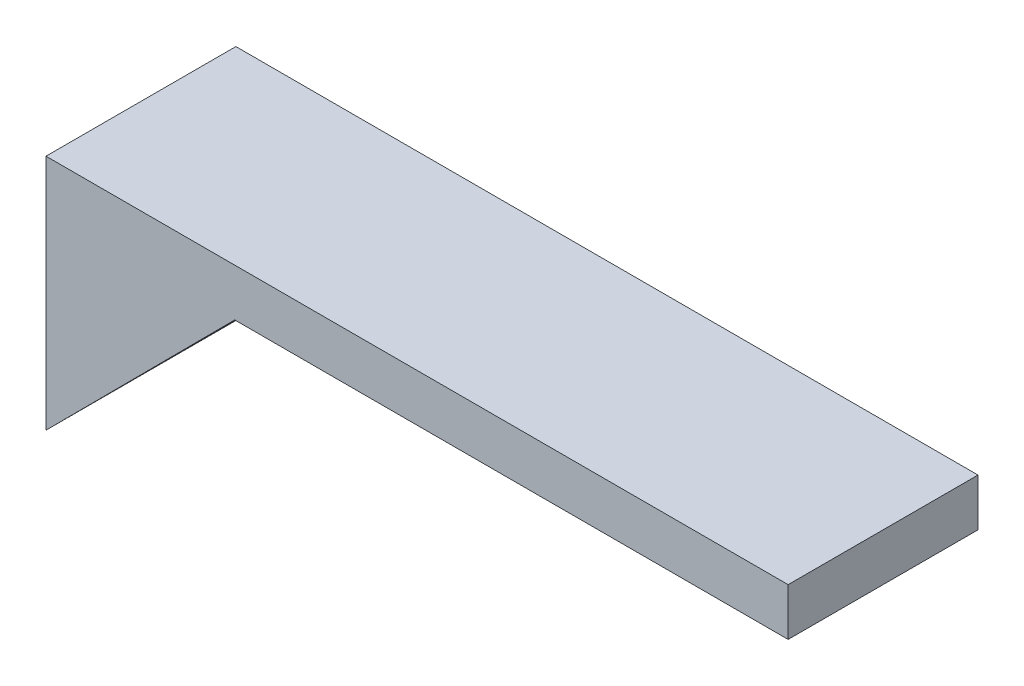
from build123d import *

# Parameters (mm, degrees)
BOSS_EXTRUDE1_DEPTH = 25.4


with BuildPart() as part:
    # Sketch1 → Boss-Extrude1 (new body)
    with BuildSketch(Plane.XY):
        Polygon((0, 0), (0, -25.4), (25.248417693, 0), (99.2874222, 0), (99.2874222, 6.35), (0, 6.35), align=None)
    extrude(amount=BOSS_EXTRUDE1_DEPTH)


solid = part.part
